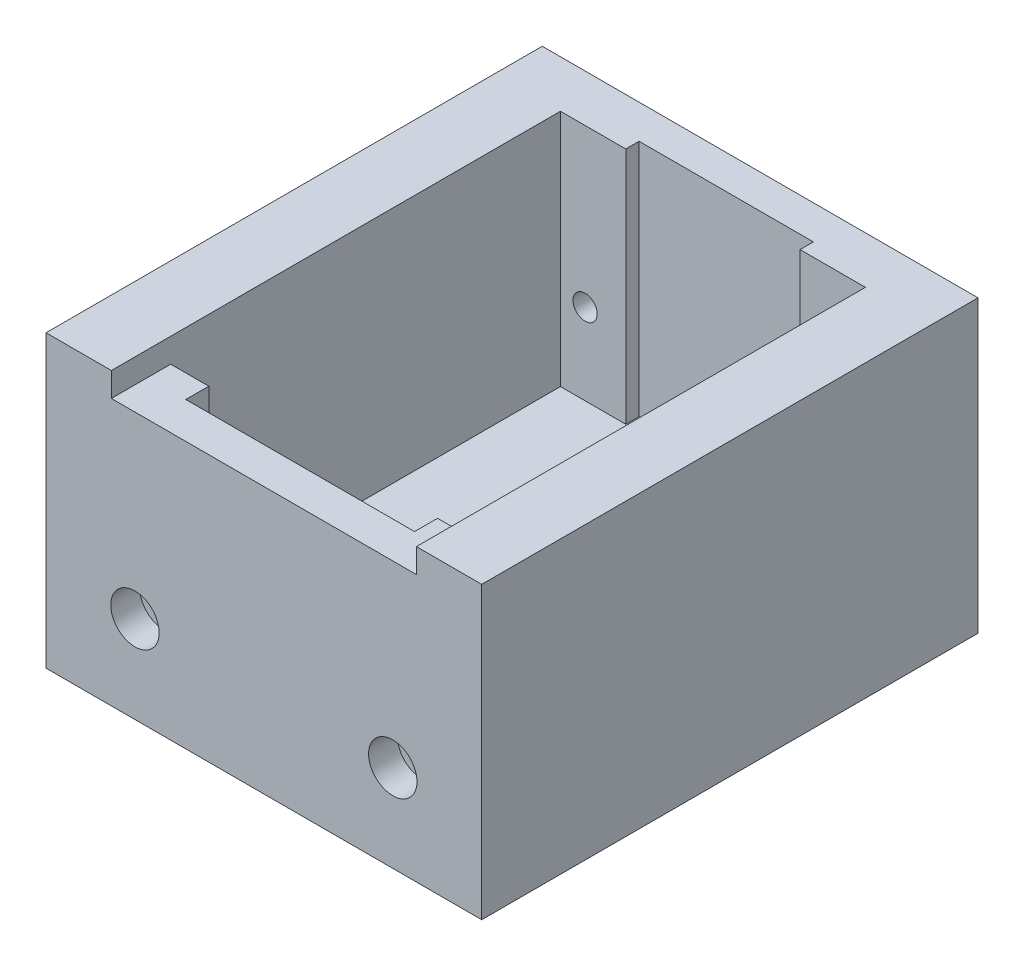
from build123d import *

# Parameters (mm, degrees)
SKETCH_3_W           = 36
SKETCH_3_H           = 50
EXTRUDE_1_DEPTH      = 24
SKETCH_4_W           = 24.8
SKETCH_4_H           = 31.8
CUT_EXTRUDE_1_DEPTH  = 19.7
SKETCH_5_W           = 14
SKETCH_5_H           = 2.2
CUT_EXTRUDE_3_DEPTH  = 19.7
SKETCH_6_W           = 18.5
SKETCH_6_H           = 3.8
CUT_EXTRUDE_4_DEPTH  = 14.7
SKETCH_7_W           = 24.8
SKETCH_7_H           = 24.280407208
CUT_EXTRUDE_5_DEPTH  = 2
SKETCH_8_R           = 2
CUT_EXTRUDE_6_DEPTH  = 6.4
SKETCH_9_R           = 1
CUT_EXTRUDE_7_DEPTH  = 6.4
SKETCH_10_R          = 2
CUT_EXTRUDE_8_DEPTH  = 7.4
SKETCH_11_R          = 1
CUT_EXTRUDE_9_DEPTH  = 7.4
SKETCH_14_W          = 47.693248889
SKETCH_14_H          = 41.94352182
CUT_EXTRUDE_12_DEPTH = 4
SKETCH_16_W          = 69.166934332
SKETCH_16_H          = 39.422219991
CUT_EXTRUDE_13_DEPTH = 5
CUT_EXTRUDE_17_DEPTH = 19.7
SKETCH_19_W          = 18.9
SKETCH_19_H          = 2.1
CUT_EXTRUDE_18_DEPTH = 12.7
SKETCH_20_W          = 25.2
SKETCH_20_H          = 38.217614171
CUT_EXTRUDE_19_DEPTH = 2


with BuildPart() as part:
    # 草图3 → 凸台-拉伸1 (new body)
    with BuildSketch(Plane(origin=(0, 0, 0), x_dir=(1, 0, 0), z_dir=(0, 1, 0))):
        Rectangle(SKETCH_3_W, SKETCH_3_H)
    extrude(amount=EXTRUDE_1_DEPTH)

    # 草图4 → 切除-拉伸1 (cut)
    with BuildSketch(Plane(origin=(0, 24, 0), x_dir=(1, 0, 0), z_dir=(0, 1, 0))):
        Rectangle(SKETCH_4_W, SKETCH_4_H)
    extrude(amount=-CUT_EXTRUDE_1_DEPTH, mode=Mode.SUBTRACT)

    # 草图5 → 切除-拉伸3 (cut)
    with BuildSketch(Plane(origin=(0, 24, 0), x_dir=(1, 0, 0), z_dir=(0, 1, 0))):
        with Locations((0, 15.9)):
            Rectangle(SKETCH_5_W, SKETCH_5_H)
    extrude(amount=-CUT_EXTRUDE_3_DEPTH, mode=Mode.SUBTRACT)

    # 草图6 → 切除-拉伸4 (cut)
    with BuildSketch(Plane(origin=(0, 24, 0), x_dir=(1, 0, 0), z_dir=(0, 1, 0))):
        with Locations((0, -15.9)):
            Rectangle(SKETCH_6_W, SKETCH_6_H)
    extrude(amount=-CUT_EXTRUDE_4_DEPTH, mode=Mode.SUBTRACT)

    # 草图7 → 切除-拉伸5 (cut)
    with BuildSketch(Plane(origin=(0, 24, 0), x_dir=(1, 0, 0), z_dir=(0, 1, 0))):
        with Locations((0, -25)):
            Rectangle(SKETCH_7_W, SKETCH_7_H)
    extrude(amount=-CUT_EXTRUDE_5_DEPTH, mode=Mode.SUBTRACT)

    # 草图8 → 切除-拉伸6 (cut)
    with BuildSketch(Plane.XY.offset(25)):
        with Locations((10.65, 7.2)):
            Circle(SKETCH_8_R)
        with Locations((-10.65, 7.2)):
            Circle(SKETCH_8_R)
    extrude(amount=-CUT_EXTRUDE_6_DEPTH, mode=Mode.SUBTRACT)

    # 草图9 → 切除-拉伸7 (cut)
    with BuildSketch(Plane.XY.offset(18.6)):
        with Locations((10.65, 7.2)):
            Circle(SKETCH_9_R)
        with Locations((-10.65, 7.2)):
            Circle(SKETCH_9_R)
    extrude(amount=-CUT_EXTRUDE_7_DEPTH, mode=Mode.SUBTRACT)

    # 草图10 → 切除-拉伸8 (cut)
    with BuildSketch(Plane(origin=(0, 0, -25), x_dir=(-1, 0, 0), z_dir=(0, 0, -1))):
        with Locations((-10.565, 11)):
            Circle(SKETCH_10_R)
        with Locations((10.56, 11)):
            Circle(SKETCH_10_R)
    extrude(amount=-CUT_EXTRUDE_8_DEPTH, mode=Mode.SUBTRACT)

    # 草图11 → 切除-拉伸9 (cut)
    with BuildSketch(Plane(origin=(0, 0, -17.6), x_dir=(-1, 0, 0), z_dir=(0, 0, -1))):
        with Locations((10.56, 11)):
            Circle(SKETCH_11_R)
        with Locations((-10.565, 11)):
            Circle(SKETCH_11_R)
    extrude(amount=-CUT_EXTRUDE_9_DEPTH, mode=Mode.SUBTRACT)

    # 草图14 → 切除-拉伸12 (cut)
    with BuildSketch(Plane.XY.offset(25)):
        with Locations((-2.653720185, 12.393348568)):
            Rectangle(SKETCH_14_W, SKETCH_14_H)
    extrude(amount=-CUT_EXTRUDE_12_DEPTH, mode=Mode.SUBTRACT)

    # 草图16 → 切除-拉伸13 (cut)
    with BuildSketch(Plane(origin=(0, 0, -25), x_dir=(-1, 0, 0), z_dir=(0, 0, -1))):
        with Locations((0.858826259, 12.588310345)):
            Rectangle(SKETCH_16_W, SKETCH_16_H)
    extrude(amount=-CUT_EXTRUDE_13_DEPTH, mode=Mode.SUBTRACT)

    # 草图18 → 切除-拉伸17 (cut)
    with BuildSketch(Plane(origin=(0, 24, 0), x_dir=(1, 0, 0), z_dir=(0, 1, 0))):
        Polygon((-12.6, -16.1), (12.6, -16.1), (12.6, 16.1), (7.2, 16.1), (7.2, 17.2), (-7.2, 17.2), (-7.2, 16.1), (-12.6, 16.1), align=None)
    extrude(amount=-CUT_EXTRUDE_17_DEPTH, mode=Mode.SUBTRACT)

    # 草图19 → 切除-拉伸18 (cut)
    with BuildSketch(Plane(origin=(0, 22, 0), x_dir=(1, 0, 0), z_dir=(0, 1, 0))):
        with Locations((0, -16.95)):
            Rectangle(SKETCH_19_W, SKETCH_19_H)
    extrude(amount=-CUT_EXTRUDE_18_DEPTH, mode=Mode.SUBTRACT)

    # 草图20 → 切除-拉伸19 (cut)
    with BuildSketch(Plane(origin=(0, 24, 0), x_dir=(1, 0, 0), z_dir=(0, 1, 0))):
        with Locations((0, -3.008807086)):
            Rectangle(SKETCH_20_W, SKETCH_20_H)
    extrude(amount=-CUT_EXTRUDE_19_DEPTH, mode=Mode.SUBTRACT)


solid = part.part
